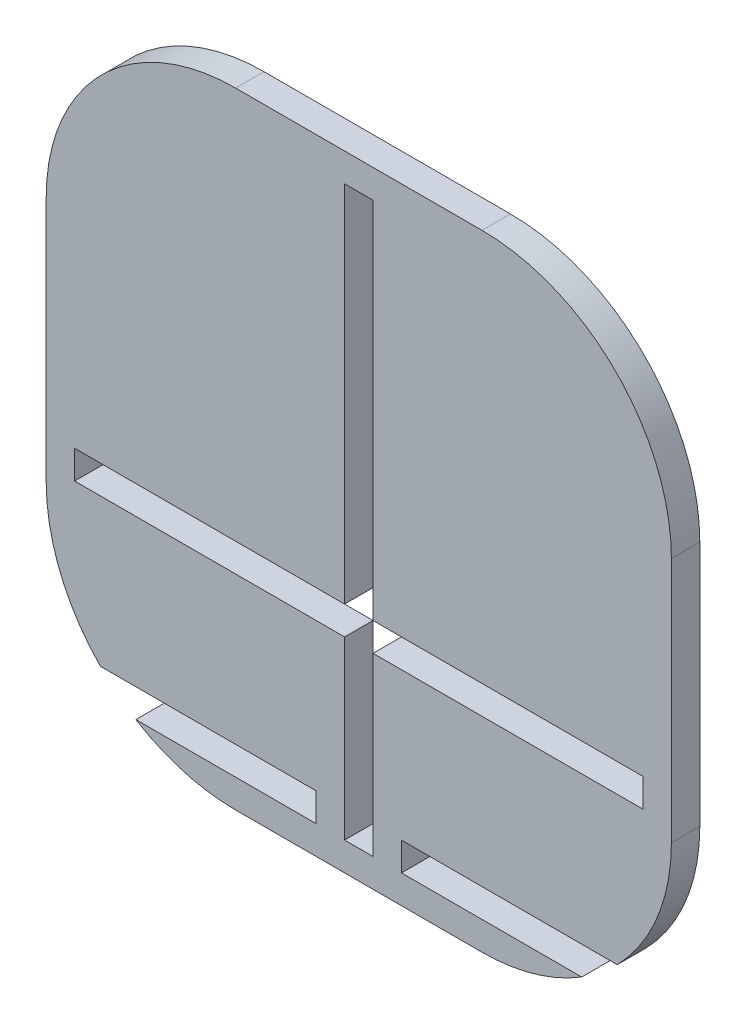
from build123d import *

# Parameters (mm, degrees)
SALIENTE_EXTRUIR1_DEPTH = 3


with BuildPart() as part:
    # Croquis1 → Saliente-Extruir1 (new body)
    with BuildSketch(Plane.XY):
        with BuildLine():
            Line((-13, -33), (13, -33))
            ThreePointArc((13, -33), (18.477225575, -32.235384062), (23.535653753, -30))
            Line((23.535653753, -30), (4.502856857, -30))
            Line((4.502856857, -30), (4.502856857, -27))
            Line((4.502856857, -27), (27.282856857, -27))
            ThreePointArc((27.282856857, -27), (31.515630385, -20.561179235), (33, -13))
            Line((33, -13), (33, 13))
            ThreePointArc((33, 13), (27.142135624, 27.142135624), (13, 33))
            Line((13, 33), (-13, 33))
            ThreePointArc((-13, 33), (-27.142135624, 27.142135624), (-33, 13))
            Line((-33, 13), (-33, -13))
            ThreePointArc((-33, -13), (-31.515630385, -20.561179235), (-27.282856857, -27))
            Line((-27.282856857, -27), (-4.502856857, -27))
            Line((-4.502856857, -27), (-4.502856857, -30))
            Line((-4.502856857, -30), (-23.535653753, -30))
            ThreePointArc((-23.535653753, -30), (-18.477225575, -32.235384062), (-13, -33))
        make_face()
        Polygon((-30, -11.425), (-30, -8.425), (-1.5, -8.425), (-1.5, 30), (1.5, 30), (1.5, -8.425), (30, -8.425), (30, -11.425), (1.5, -11.425), (1.5, -30), (-1.5, -30), (-1.5, -11.425), align=None, mode=Mode.SUBTRACT)
    extrude(amount=SALIENTE_EXTRUIR1_DEPTH)


solid = part.part
